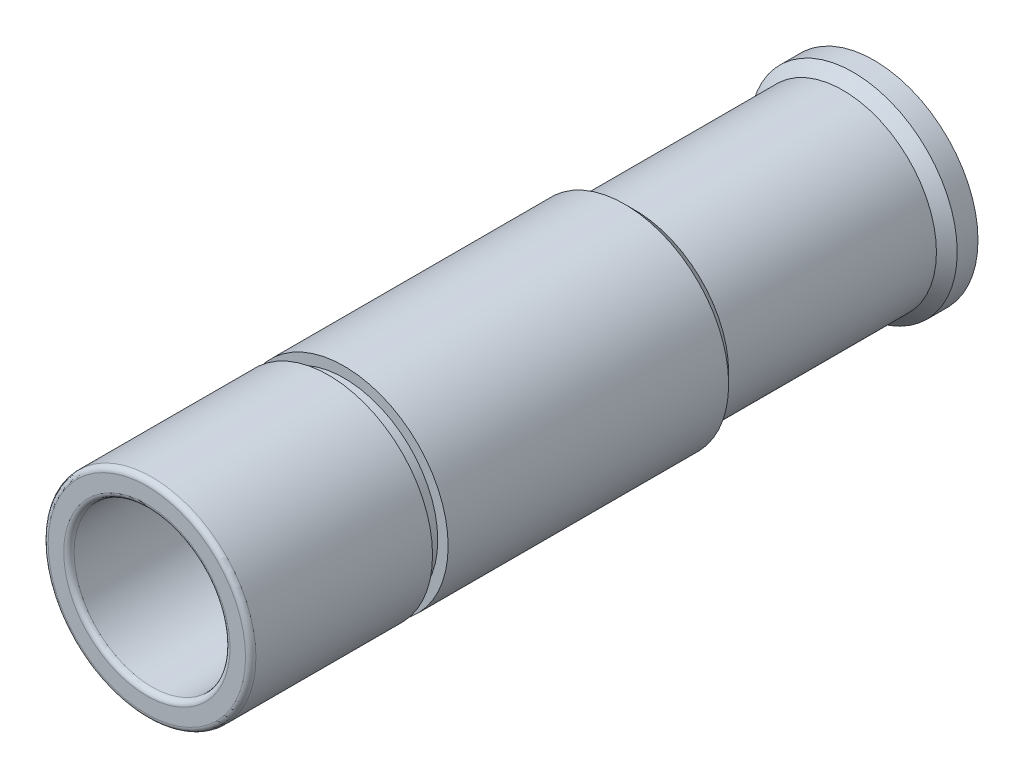
from build123d import *

# Parameters (mm, degrees)
FILLET_1_R = 0.25


with BuildPart() as part:
    # Эскиз1 → Повернуть1 (revolve)
    with BuildSketch(Plane(origin=(0, 0, 0), x_dir=(0, 0, -1), z_dir=(1, 0, 0)), mode=Mode.PRIVATE) as revolve_1_sk:
        Polygon((23, 0), (35, 0), (35, 5), (34, 5), (33.5, 4.5), (23.5, 4.5), (23, 5), (9.5, 5), (9.5, 4.5), (8.75, 4.5), (8.75, 5), (0, 5), (0, 3.75), (23, 3.75), align=None)
    revolve(revolve_1_sk.sketch.rotate(Axis((0, 0, -23), (0, 0, -1)), 90), axis=Axis((0, 0, -23), (0, 0, -1)))

    # Скругление1
    fillet_1_edges = [part.edges().sort_by_distance(p)[0] for p in [
        (-3.75, 0, 0),
        (-5, 0, 0),
    ]]
    fillet(fillet_1_edges, radius=FILLET_1_R)


solid = part.part
